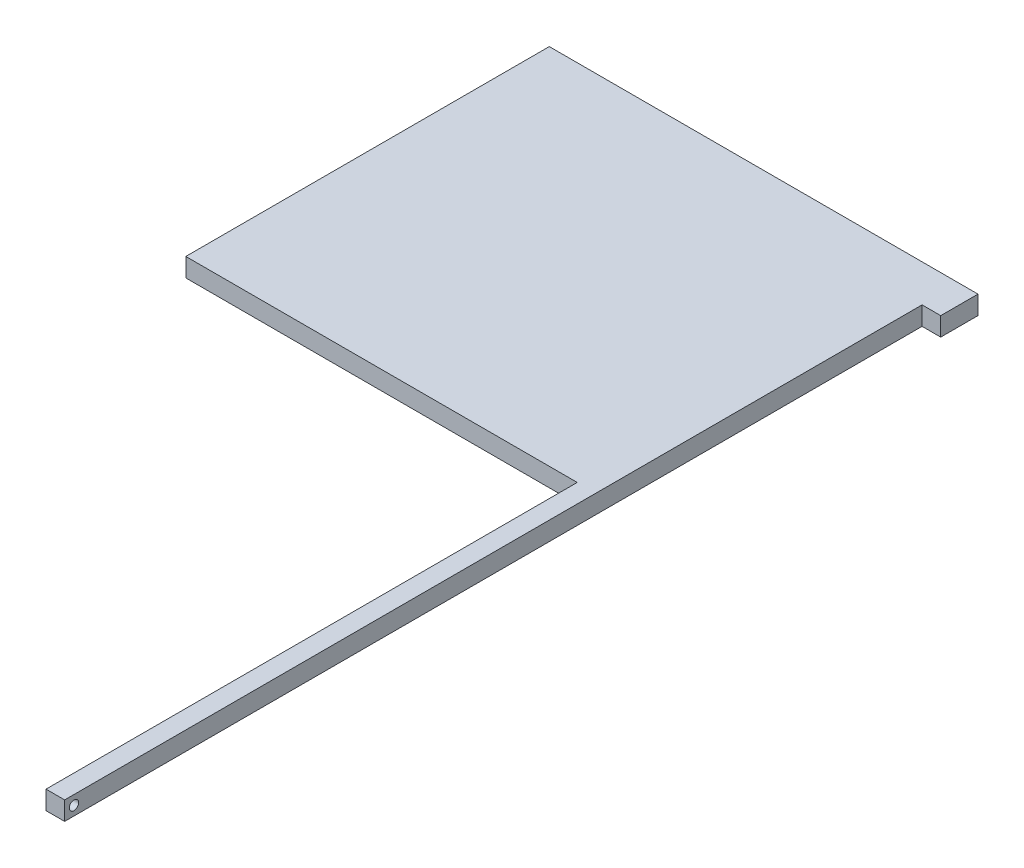
from build123d import *

# Parameters (mm, degrees)
SKETCH1_W               = 482.6
SKETCH1_H               = 304.8
BOSS_EXTRUDE1_DEPTH     = 12.7
BOSS_EXTRUDE2_DEPTH     = 6.35
SKETCH3_R               = 1.5875
CUT_EXTRUDE1_DEPTH      = 507.449822292
SKETCH4_W               = 6.35
SKETCH4_H               = 12.7
BOSS_EXTRUDE3_DEPTH     = 292.1
SKETCH5_W               = 12.7
SKETCH5_H               = 19.05
BOSS_EXTRUDE4_DEPTH     = 6.35
CUT_EXTRUDE2_START      = 6.35
CUT_EXTRUDE2_DEPTH      = 25.4
CUT_EXTRUDE3_START      = -488.95
CUT_EXTRUDE3_DEPTH      = 25.4
BOSS_EXTRUDE5_START     = -2.54
BOSS_EXTRUDE5_DEPTH     = 7.62
CUT_EXTRUDE5_DEPTH      = 582.883177708
CUT_EXTRUDE5_DEPTH_BACK = 582.883177708
SKETCH13_W              = 304.8
SKETCH13_H              = 12.7
SKETCH17_W              = 385.398698987
SKETCH17_H              = 324.595378491
CUT_EXTRUDE8_DEPTH      = 291.854955261


with BuildPart() as part:
    # Sketch1 → Boss-Extrude1 (new body)
    with BuildSketch(Plane(origin=(0, 0, 0), x_dir=(1, 0, 0), z_dir=(0, 1, 0))):
        Rectangle(SKETCH1_W, SKETCH1_H)
    extrude(amount=BOSS_EXTRUDE1_DEPTH)

    # Sketch2 → Boss-Extrude2 (add)
    with BuildSketch(Plane(origin=(0, 12.7, 0), x_dir=(1, 0, 0), z_dir=(0, 1, 0))):
        Polygon((-241.3, 152.4), (-234.95, 152.4), (234.95, 152.4), (241.3, 152.4), (241.3, -152.4), (234.95, -152.4), (234.95, 28.575), (-234.95, 28.575), (-234.95, -152.4), (-241.3, -152.4), align=None)
    extrude(amount=BOSS_EXTRUDE2_DEPTH)

    # Sketch3 → Cut-Extrude1 (cut, through all)
    with BuildSketch(Plane.ZY.offset(241.3)):
        with Locations((149.225, 15.875)):
            Circle(SKETCH3_R)
    extrude(amount=-CUT_EXTRUDE1_DEPTH, mode=Mode.SUBTRACT)

    # Sketch4 → Boss-Extrude3 (add)
    with BuildSketch(Plane.XY.offset(152.4)):
        with Locations((-244.475, 6.35)):
            Rectangle(SKETCH4_W, SKETCH4_H)
    boss_extrude3 = extrude(amount=-BOSS_EXTRUDE3_DEPTH)

    # Sketch5 → Boss-Extrude4 (add)
    with BuildSketch(Plane.ZY.offset(241.3)):
        with Locations((-146.05, 9.525)):
            Rectangle(SKETCH5_W, SKETCH5_H)
    boss_extrude4 = extrude(amount=BOSS_EXTRUDE4_DEPTH)

    # Mirror1: Boss-Extrude3, Boss-Extrude4 across plane
    add(boss_extrude3.mirror(Plane(origin=(0, 0, 0), x_dir=(0, 0, 1), z_dir=(1, 0, 0))))
    add(boss_extrude4.mirror(Plane(origin=(0, 0, 0), x_dir=(0, 0, 1), z_dir=(1, 0, 0))))

    # Sketch6 → Cut-Extrude2 (cut)
    with BuildSketch(Plane.ZY.offset(241.3).offset(CUT_EXTRUDE2_START)):
        with BuildLine():
            Line((147.32, 2.54), (128.27, 2.54))
            ThreePointArc((128.27, 2.54), (124.46, 6.35), (128.27, 10.16))
            Line((128.27, 10.16), (147.32, 10.16))
            ThreePointArc((147.32, 10.16), (151.13, 6.35), (147.32, 2.54))
        make_face()
    extrude(amount=-CUT_EXTRUDE2_DEPTH, mode=Mode.SUBTRACT)

    # Sketch6<2> → Cut-Extrude3 (cut)
    with BuildSketch(Plane.ZY.offset(241.3).offset(CUT_EXTRUDE3_START)):
        with BuildLine():
            Line((147.32, 2.54), (128.27, 2.54))
            ThreePointArc((128.27, 2.54), (124.46, 6.35), (128.27, 10.16))
            Line((128.27, 10.16), (147.32, 10.16))
            ThreePointArc((147.32, 10.16), (151.13, 6.35), (147.32, 2.54))
        make_face()
    extrude(amount=CUT_EXTRUDE3_DEPTH, mode=Mode.SUBTRACT)

    # Sketch11 → Boss-Extrude5 (add)
    with BuildSketch(Plane.XZ.offset(BOSS_EXTRUDE5_START)):
        Polygon((-247.65, 124.46), (-222.25, 124.46), (-222.25, 140.97), align=None)
    boss_extrude5 = extrude(amount=-BOSS_EXTRUDE5_DEPTH)

    # Mirror2: Boss-Extrude5 across plane
    add(boss_extrude5.mirror(Plane(origin=(0, 0, 0), x_dir=(0, 0, 1), z_dir=(1, 0, 0))))

    # Sketch13 → Cut-Extrude5 (cut, two sides: drawn at the far end of the back side and taken through both)
    with BuildSketch(Plane(origin=(247.65, 19.05, -152.4), x_dir=(0, 0, 1), z_dir=(-1, 0, 0)).offset(-CUT_EXTRUDE5_DEPTH_BACK)):
        with Locations((152.4, -12.7)):
            Rectangle(SKETCH13_W, SKETCH13_H)
    extrude(amount=CUT_EXTRUDE5_DEPTH + CUT_EXTRUDE5_DEPTH_BACK, mode=Mode.SUBTRACT)

    # Sketch17 → Cut-Extrude8 (cut, through all)
    with BuildSketch(Plane(origin=(0, 19.05, 0), x_dir=(1, 0, 0), z_dir=(0, 1, 0))):
        with Locations((-91.099349494, -9.897689246)):
            Rectangle(SKETCH17_W, SKETCH17_H)
    extrude(amount=-CUT_EXTRUDE8_DEPTH, mode=Mode.SUBTRACT)


solid = part.part
